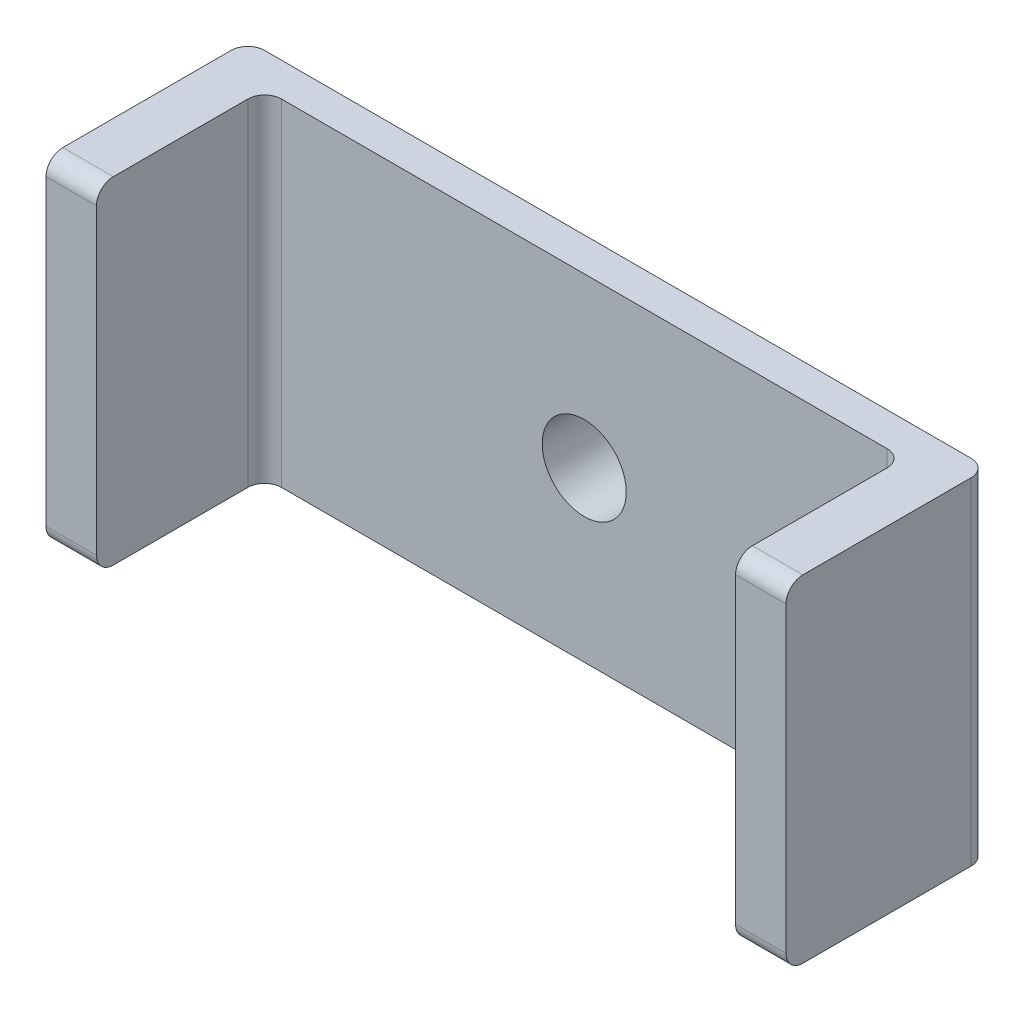
from build123d import *

# Parameters (mm, degrees)
SKETCH_1_R        = 14.5
SKETCH_1_R_2      = 12.5
EXTRUDE_1_DEPTH   = 15
EXTRUDE_START     = 10
SKETCH_1_3_W      = 220
SKETCH_1_3_H      = 100
SKETCH_1_3_R      = 12.5
EXTRUDE_1_2_DEPTH = 10
SKETCH_2_W        = 15
SKETCH_2_H        = 100
EXTRUDE_2_DEPTH   = 50
FILLET_1_R        = 5


with BuildPart() as part:
    # 草图1 → Extrude 1 (new body)
    with BuildSketch(Plane.XY):
        Circle(SKETCH_1_R)
        Circle(SKETCH_1_R_2, mode=Mode.SUBTRACT)
    extrude(amount=-EXTRUDE_1_DEPTH)

    # 草图1<3> → Extrude 1 2 (add)
    with BuildSketch(Plane.XY.offset(EXTRUDE_START)):
        Rectangle(SKETCH_1_3_W, SKETCH_1_3_H)
        Circle(SKETCH_1_3_R, mode=Mode.SUBTRACT)
    extrude(amount=-EXTRUDE_1_2_DEPTH)

    # 草图2 → 凸台-拉伸2 (add)
    with BuildSketch(Plane.XY.offset(10)):
        with Locations((-102.5, 0)):
            Rectangle(SKETCH_2_W, SKETCH_2_H)
        with Locations((102.5, 0)):
            Rectangle(SKETCH_2_W, SKETCH_2_H)
    extrude(amount=EXTRUDE_2_DEPTH)

    # 圆角1
    fillet_1_edges = [part.edges().sort_by_distance(p)[0] for p in [
        (-110, 0, 0),
        (110, 0, 0),
        (95, 0, 10),
        (-95, 0, 10),
        (102.5, 50, 60),
        (102.5, -50, 60),
        (-102.5, -50, 60),
        (-102.5, 50, 60),
    ]]
    fillet(fillet_1_edges, radius=FILLET_1_R)


solid = part.part
